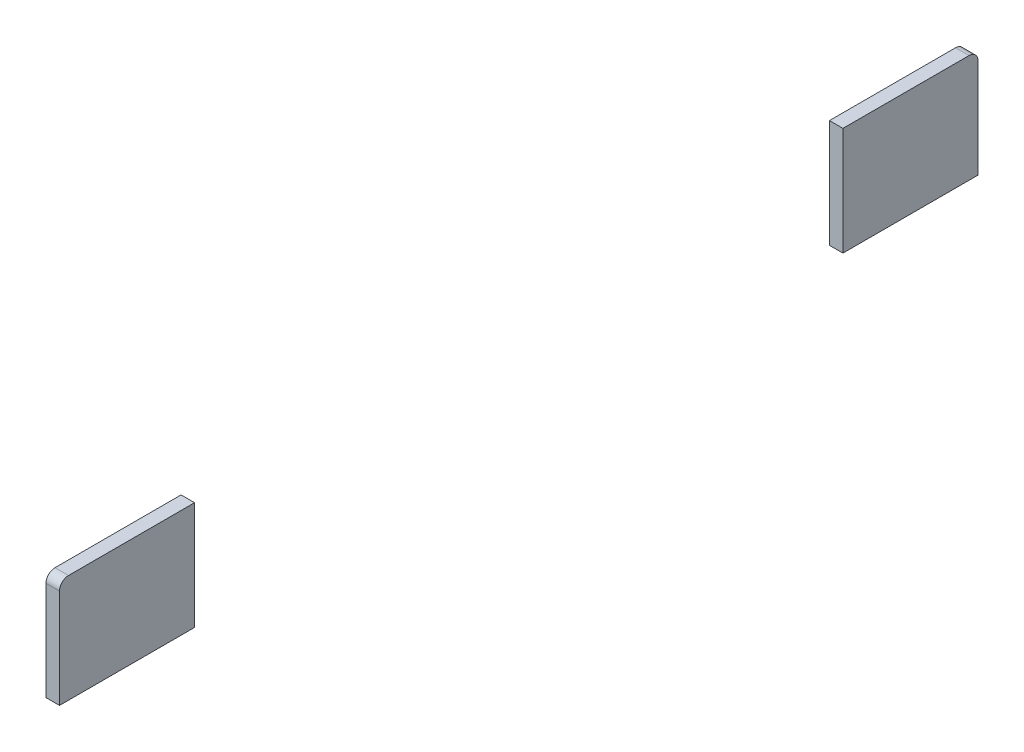
from build123d import *

# Parameters (mm, degrees)
BOSS_EXTRUDE1_DEPTH   = 1.5
BOSS_EXTRUDE1_2_DEPTH = 1.5


with BuildPart() as part:
    # Sketch1 → Boss-Extrude1 (new body)
    with BuildSketch(Plane(origin=(0, 0, 0), x_dir=(0, 0, -1), z_dir=(1, 0, 0))):
        with BuildLine():
            Line((0, 0), (15, 0))
            Line((15, 0), (15, 11))
            ThreePointArc((15, 11), (14.707106781, 11.707106781), (14, 12))
            Line((14, 12), (0, 12))
            Line((0, 12), (0, 0))
        make_face()
    extrude(amount=BOSS_EXTRUDE1_DEPTH)


with BuildPart() as body_2:
    # Sketch1 → Boss-Extrude1 2 (new body)
    with BuildSketch(Plane(origin=(0, 0, 0), x_dir=(0, 0, -1), z_dir=(1, 0, 0))):
        with BuildLine():
            Line((-87, 0), (-87, 11))
            ThreePointArc((-87, 11), (-86.707106781, 11.707106781), (-86, 12))
            Line((-86, 12), (-72, 12))
            Line((-72, 12), (-72, 0))
            Line((-72, 0), (-87, 0))
        make_face()
    extrude(amount=BOSS_EXTRUDE1_2_DEPTH)


solid = Compound([part.part, body_2.part])
